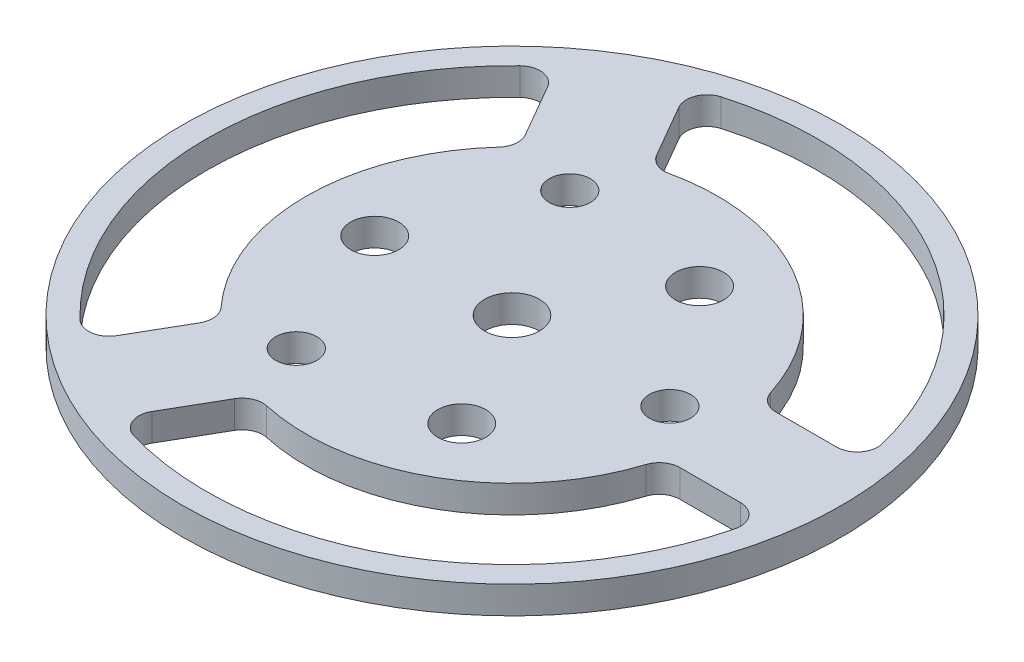
from build123d import *

# Parameters (mm, degrees)
SKETCH1_R           = 24
SKETCH1_R_2         = 2
SKETCH1_R_3         = 1.5
BOSS_EXTRUDE1_DEPTH = 2
CUT_EXTRUDE1_DEPTH  = 2
FILLET1_R           = 1.5
SKETCH3_R           = 1.75
CUT_EXTRUDE2_DEPTH  = 10


with BuildPart() as part:
    # Sketch1 → Boss-Extrude1 (new body)
    with BuildSketch(Plane(origin=(0, 0, 0), x_dir=(1, 0, 0), z_dir=(0, 1, 0))):
        with Locations(Location((0, 0, 0), (0, 0, 270))):
            Circle(SKETCH1_R)
        with Locations(Location((0, 0, 0), (0, 0, 270))):
            Circle(SKETCH1_R_2, mode=Mode.SUBTRACT)
        with Locations(Location((11.5, 0, 0), (0, 0, 270))):
            Circle(SKETCH1_R_3, mode=Mode.SUBTRACT)
        with Locations(Location((-5.75, -9.959292144, 0), (0, 0, 270))):
            Circle(SKETCH1_R_3, mode=Mode.SUBTRACT)
        with Locations(Location((-5.75, 9.959292144, 0), (0, 0, 270))):
            Circle(SKETCH1_R_3, mode=Mode.SUBTRACT)
    extrude(amount=BOSS_EXTRUDE1_DEPTH)

    # Sketch2 → Cut-Extrude1 (cut)
    with BuildSketch(Plane(origin=(0, 2, 0), x_dir=(1, 0, 0), z_dir=(0, 1, 0))):
        with BuildLine():
            Line((21.972994789, 3.5), (14.585952146, 3.5))
            ThreePointArc((14.585952146, 3.5), (7.5, 12.990381057), (-4.26188716, 14.381805097))
            Line((-4.26188716, 14.381805097), (-7.955408481, 20.779171685))
            ThreePointArc((-7.955408481, 20.779171685), (11.125, 19.269065234), (21.972994789, 3.5))
        make_face()
        with BuildLine():
            Line((21.972994789, -3.5), (14.585952146, -3.5))
            ThreePointArc((14.585952146, -3.5), (7.5, -12.990381057), (-4.26188716, -14.381805097))
            Line((-4.26188716, -14.381805097), (-7.955408481, -20.779171685))
            ThreePointArc((-7.955408481, -20.779171685), (11.125, -19.269065234), (21.972994789, -3.5))
        make_face()
        with BuildLine():
            Line((-14.017586308, -17.279171685), (-10.324064986, -10.881805097))
            ThreePointArc((-10.324064986, -10.881805097), (-15, 0), (-10.324064986, 10.881805097))
            Line((-10.324064986, 10.881805097), (-14.017586308, 17.279171685))
            ThreePointArc((-14.017586308, 17.279171685), (-22.25, 0), (-14.017586308, -17.279171685))
        make_face()
    extrude(amount=-CUT_EXTRUDE1_DEPTH, mode=Mode.SUBTRACT)

    # Fillet1
    fillet1_edges = [part.edges().sort_by_distance(p)[0] for p in [
        (-7.955408481, 1, -20.779171685),
        (21.972994789, 1, -3.5),
        (14.585952146, 1, -3.5),
        (-4.26188716, 1, -14.381805097),
        (-14.017586308, 1, 17.279171685),
        (-14.017586308, 1, -17.279171685),
        (-10.324064986, 1, -10.881805097),
        (-10.324064986, 1, 10.881805097),
        (21.972994789, 1, 3.5),
        (-7.955408481, 1, 20.779171685),
        (-4.26188716, 1, 14.381805097),
        (14.585952146, 1, 3.5),
    ]]
    fillet(fillet1_edges, radius=FILLET1_R)

    # Sketch3 → Cut-Extrude2 (cut)
    with BuildSketch(Plane(origin=(0, 2, 0), x_dir=(1, 0, 0), z_dir=(0, 1, 0))):
        with Locations(Location((5, 8.660254038, 0), (0, 0, 270))):
            Circle(SKETCH3_R)
        with Locations(Location((5, -8.660254038, 0), (0, 0, 270))):
            Circle(SKETCH3_R)
        with Locations(Location((-10, 0, 0), (0, 0, 270))):
            Circle(SKETCH3_R)
    extrude(amount=-CUT_EXTRUDE2_DEPTH, mode=Mode.SUBTRACT)


solid = part.part
